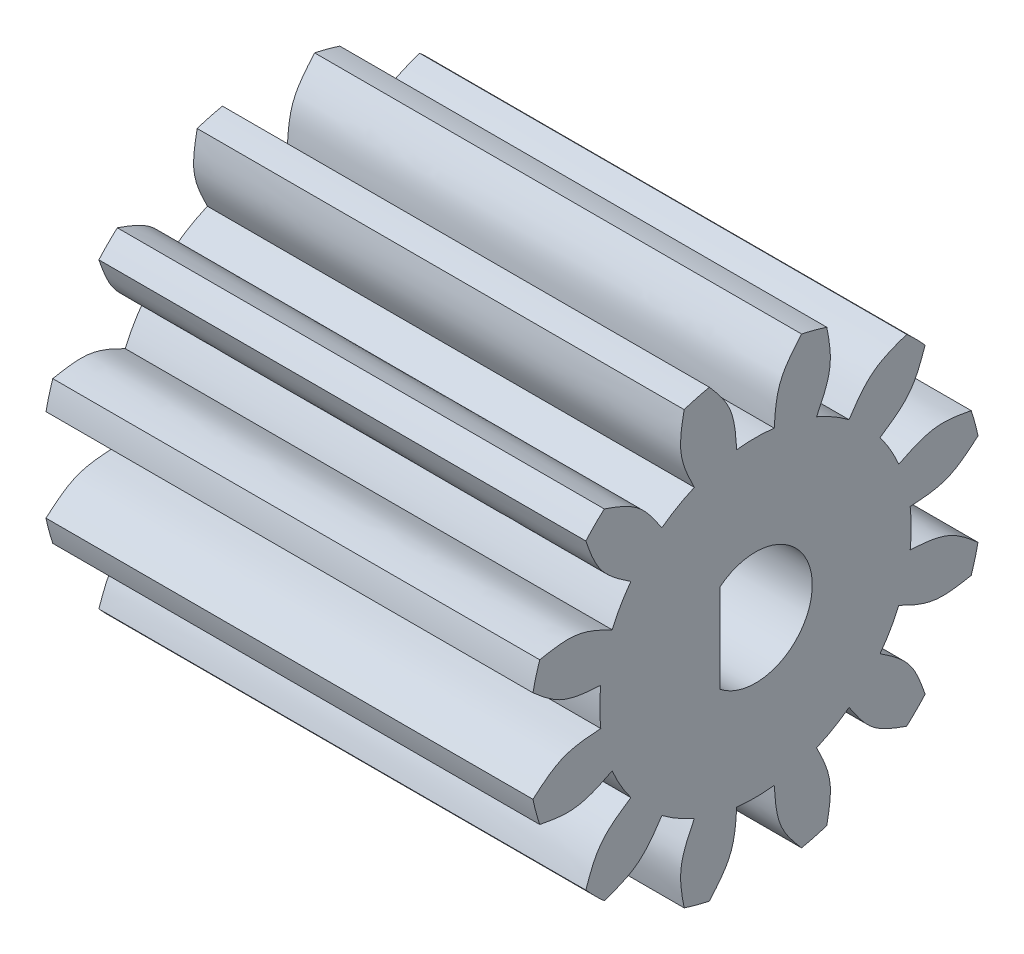
from build123d import *

# Parameters (mm, degrees)
KUGGLUCKA_DEPTH    = 15
CIRPATTERN_COUNT   = 12
CUT_EXTRUDE1_START = -10
SKETCH1_R          = 4.5
CUT_EXTRUDE1_DEPTH = 10
CUT_EXTRUDE2_DEPTH = 10


with BuildPart() as part:
    # Ritning 1 → Kugghjulsämne (revolve)
    with BuildSketch(Plane.XY, mode=Mode.PRIVATE) as kugghjuls_mne_sk:
        Polygon((12.5, 1), (2.5, 1), (2.5, 3.5), (-12.5, 3.5), (-12.5, -3.5), (12.5, -3.5), align=None)
    revolve(kugghjuls_mne_sk.sketch.rotate(Axis((-12.5, -3.5, 0), (1, 0, 0)), 90), axis=Axis((-12.5, -3.5, 0), (1, 0, 0)))

    # Ritning 2 → Kugglucka (cut)
    with BuildSketch(Plane.ZY.offset(12.5)):
        with BuildLine():
            Line((1.419865071, 3.354486354), (0, 4.774351425))
            Line((0, 4.774351425), (-1.419865071, 3.354486354))
            add(Edge.make_bspline(
                [(-1.419865071, 3.354486354), (-1.173032372, 3.067088657), (-0.658113481, 2.467546927), (-0.604624671, 1.6768746), (-0.576776379, 1.265220772)],
                knots=[0, 0, 0, 0, 0.479362292, 1, 1, 1, 1], degree=3))
            ThreePointArc((-0.576776379, 1.265220772), (0, 1.3), (0.576776379, 1.265220772))
            add(Edge.make_bspline(
                [(1.419865071, 3.354486354), (1.173032372, 3.067088657), (0.658113481, 2.467546927), (0.604624671, 1.6768746), (0.576776379, 1.265220772)],
                knots=[0, 0, 0, 0, 0.479362292, 1, 1, 1, 1], degree=3))
        make_face()
    kugglucka = extrude(amount=-KUGGLUCKA_DEPTH, mode=Mode.SUBTRACT)

    # CirPattern: Kugglucka ×12 about axis
    cirpattern_axis = Axis((-12.5, -3.5, 0), (-1, 0, 0))
    for i in range(1, CIRPATTERN_COUNT):
        add(kugglucka.rotate(cirpattern_axis, i * 360 / CIRPATTERN_COUNT), mode=Mode.SUBTRACT)

    # Sketch1 → Cut-Extrude1 (cut)
    with BuildSketch(Plane(origin=(12.5, 0, 0), x_dir=(0, 0, -1), z_dir=(1, 0, 0)).offset(CUT_EXTRUDE1_START)):
        with Locations((0, -3.5)):
            Circle(SKETCH1_R)
    extrude(amount=CUT_EXTRUDE1_DEPTH, mode=Mode.SUBTRACT)

    # Sketch2 → Cut-Extrude2 (cut)
    with BuildSketch(Plane(origin=(2.5, 0, 0), x_dir=(0, 0, -1), z_dir=(1, 0, 0))):
        with BuildLine():
            Line((-1.1, -2.138934241), (-1.1, -4.861065759))
            ThreePointArc((-1.1, -4.861065759), (1.75, -3.5), (-1.1, -2.138934241))
        make_face()
    extrude(amount=-CUT_EXTRUDE2_DEPTH, mode=Mode.SUBTRACT)


solid = part.part
